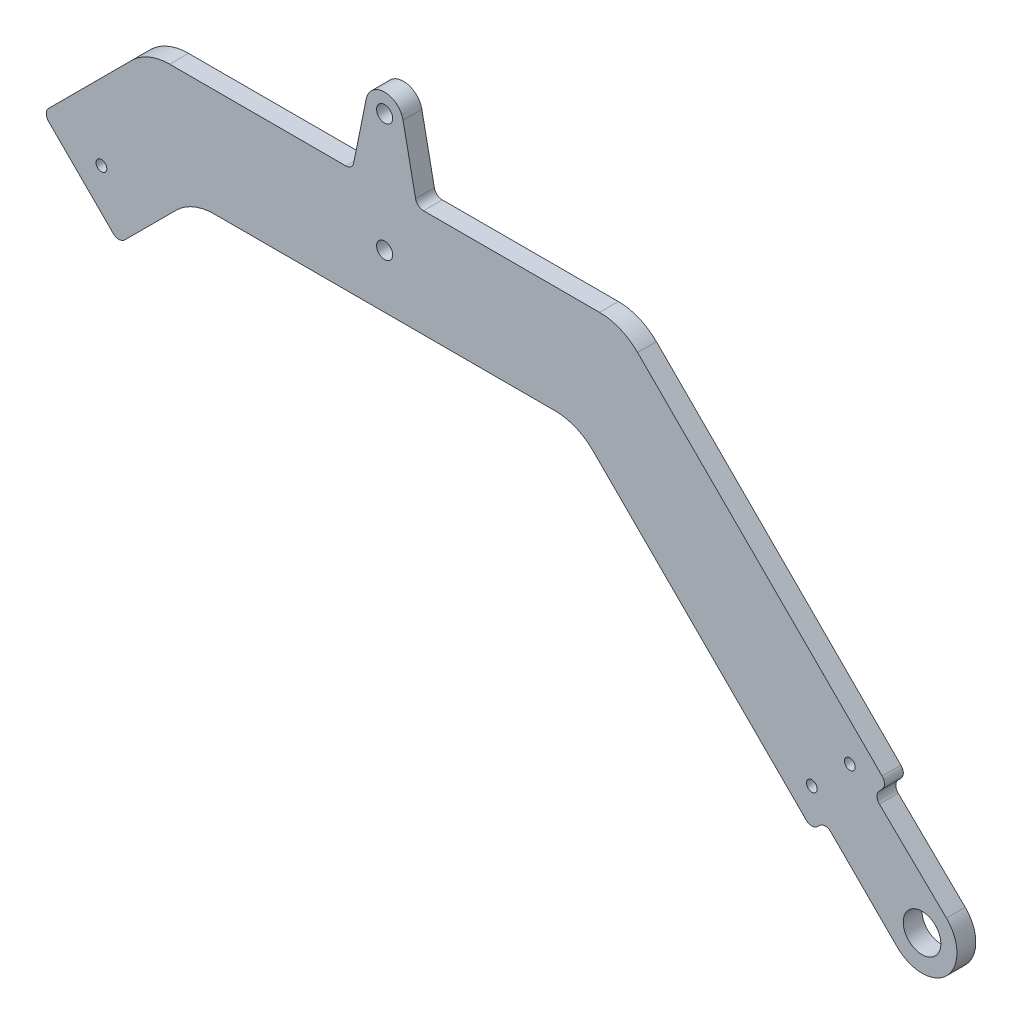
from build123d import *

# Parameters (mm, degrees)
SKETCH7_R           = 3.5
SKETCH7_R_2         = 1.5
SKETCH7_R_3         = 1
BOSS_EXTRUDE2_DEPTH = 3.5
FILLET1_R           = 10
FILLET2_R           = 1.5


with BuildPart() as part:
    # Sketch7 → Boss-Extrude2 (new body)
    with BuildSketch(Plane.XY):
        with BuildLine():
            Line((3.430427898, 82.694380615), (6, 70))
            Line((6, 70), (44.142135624, 70))
            Line((44.142135624, 70), (93.636038969, 20.506096654))
            Line((93.636038969, 20.506096654), (90.980851591, 17.850909276))
            Line((90.980851591, 17.850909276), (104.533955357, 4.657601188))
            ThreePointArc((104.533955357, 4.657601188), (104.627002282, -4.565177968), (95.403805922, -4.596194078))
            Line((95.403805922, -4.596194078), (81.96877708, 8.838834765))
            Line((81.96877708, 8.838834765), (79.493903346, 6.363961031))
            Line((79.493903346, 6.363961031), (35.857864376, 50))
            Line((35.857864376, 50), (-35.857864376, 50))
            Line((-35.857864376, 50), (-49.445436483, 36.412427894))
            Line((-49.445436483, 36.412427894), (-63.587572106, 50.554563517))
            Line((-63.587572106, 50.554563517), (-44.142135624, 70))
            Line((-44.142135624, 70), (-6, 70))
            Line((-6, 70), (-3.430427898, 82.694380615))
            ThreePointArc((-3.430427898, 82.694380615), (0, 85.5), (3.430427898, 82.694380615))
        make_face()
        with Locations((100, 0)):
            Circle(SKETCH7_R, mode=Mode.SUBTRACT)
        with Locations((0, 82)):
            Circle(SKETCH7_R_2, mode=Mode.SUBTRACT)
        with Locations((0, 60)):
            Circle(SKETCH7_R_2, mode=Mode.SUBTRACT)
        with Locations((86.564971157, 20.506096654)):
            Circle(SKETCH7_R_3, mode=Mode.SUBTRACT)
        with Locations((79.493903346, 13.435028843)):
            Circle(SKETCH7_R_3, mode=Mode.SUBTRACT)
        with Locations((-52.699132326, 47.300867674)):
            Circle(SKETCH7_R_3, mode=Mode.SUBTRACT)
    extrude(amount=BOSS_EXTRUDE2_DEPTH)

    # Fillet1
    fillet1_edges = [part.edges().sort_by_distance(p)[0] for p in [
        (44.142135624, 70, 1.75),
        (35.857864376, 50, 1.75),
        (-35.857864376, 50, 1.75),
        (-44.142135624, 70, 1.75),
    ]]
    fillet(fillet1_edges, radius=FILLET1_R)

    # Fillet2
    fillet2_edges = [part.edges().sort_by_distance(p)[0] for p in [
        (6, 70, 1.75),
        (93.636038969, 20.506096654, 1.75),
        (90.980851591, 17.850909276, 1.75),
        (81.96877708, 8.838834765, 1.75),
        (79.493903346, 6.363961031, 1.75),
        (-49.445436483, 36.412427894, 1.75),
        (-63.587572106, 50.554563517, 1.75),
        (-6, 70, 1.75),
    ]]
    fillet(fillet2_edges, radius=FILLET2_R)


solid = part.part
